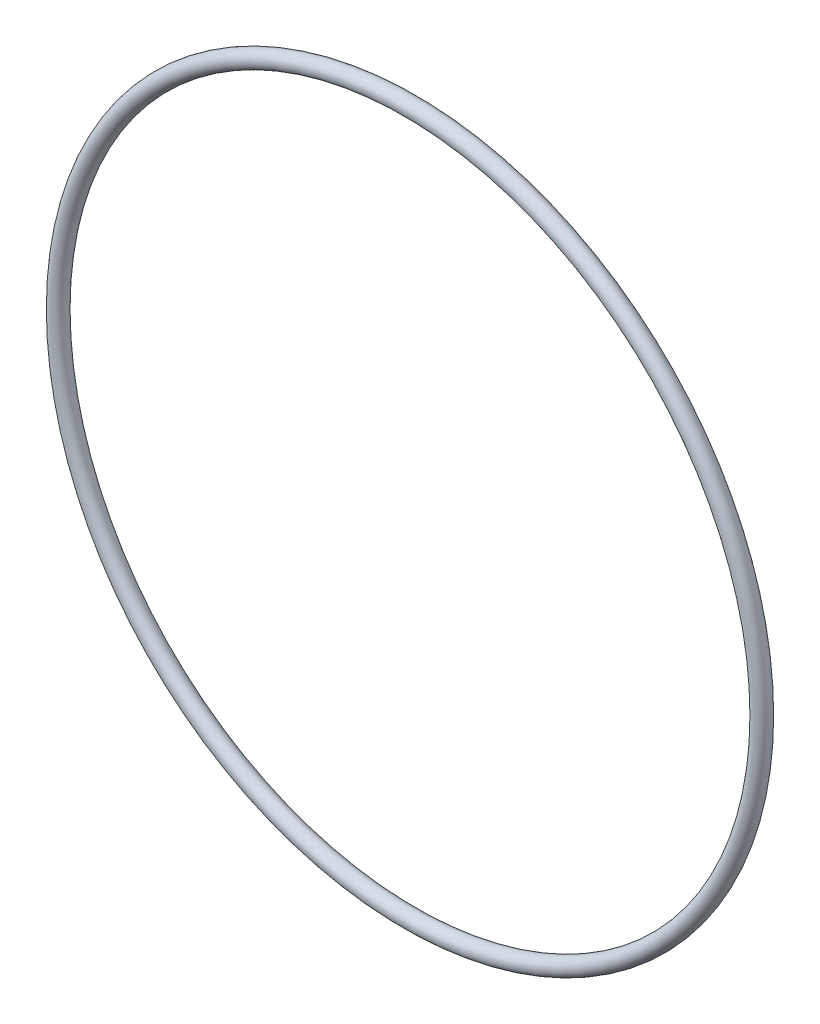
from build123d import *

# Parameters (mm, degrees)
SKETCH1_R = 0.889


with BuildPart() as part:
    # Sketch1 → Revolve1 (revolve)
    with BuildSketch(Plane(origin=(0, 0, 0), x_dir=(0, -1, 0), z_dir=(1, 0, 0)), mode=Mode.PRIVATE) as revolve1_sk:
        with Locations((37.2618, 0)):
            Circle(SKETCH1_R)
    revolve(revolve1_sk.sketch.rotate(Axis((0, 0, 0.889), (0, 0, -1)), 270), axis=Axis((0, 0, 0.889), (0, 0, -1)))


solid = part.part
